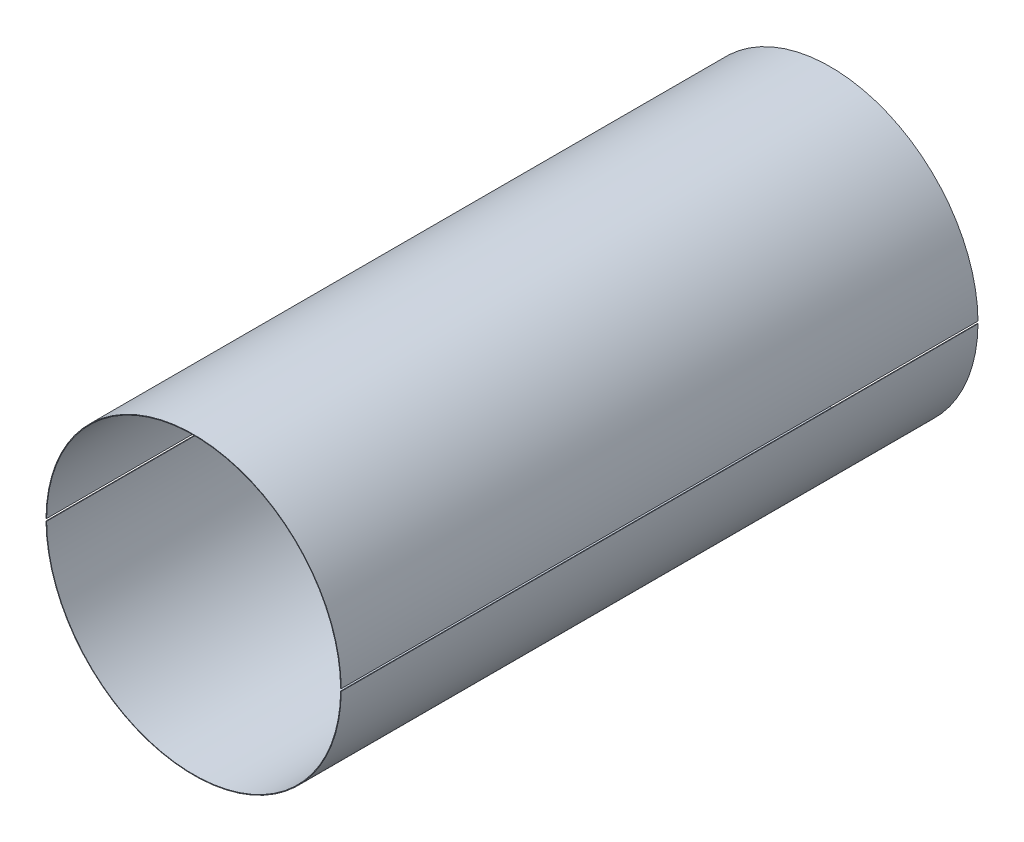
from build123d import *

# Parameters (mm, degrees)
SKETCH2_R               = 64.77
SKETCH2_R_2             = 64.516
BOSS_EXTRUDE1_DEPTH     = 279.4
CUT_EXTRUDE1_DEPTH      = 315.706410008
CUT_EXTRUDE1_DEPTH_BACK = 315.706410008
SKETCH5_W               = 279.4
SKETCH5_H               = 1.016


with BuildPart() as part:
    # Sketch2 → Boss-Extrude1 (new body)
    with BuildSketch(Plane.XY):
        Circle(SKETCH2_R)
        Circle(SKETCH2_R_2, mode=Mode.SUBTRACT)
    extrude(amount=BOSS_EXTRUDE1_DEPTH)

    # Sketch5 → Cut-Extrude1 (cut, two sides: drawn at the far end of the back side and taken through both)
    with BuildSketch(Plane.ZY.offset(64.77).offset(-CUT_EXTRUDE1_DEPTH_BACK)):
        with Locations((139.7, 0)):
            Rectangle(SKETCH5_W, SKETCH5_H)
    extrude(amount=CUT_EXTRUDE1_DEPTH + CUT_EXTRUDE1_DEPTH_BACK, mode=Mode.SUBTRACT)


with BuildPart() as cut_extrude1_piece_1:
    # of the separate pieces the step leaves, piece 1, a body of its own (cut_extrude1_pieces)
    add(part.part.solids().sort_by_distance((-64.768007812, -0.508, 0))[0])


with BuildPart() as cut_extrude1_piece_2:
    # of the separate pieces the step leaves, piece 2, a body of its own (cut_extrude1_pieces)
    add(part.part.solids().sort_by_distance((64.768007812, 0.508, 0))[0])


solid = Compound([cut_extrude1_piece_1.part, cut_extrude1_piece_2.part])
